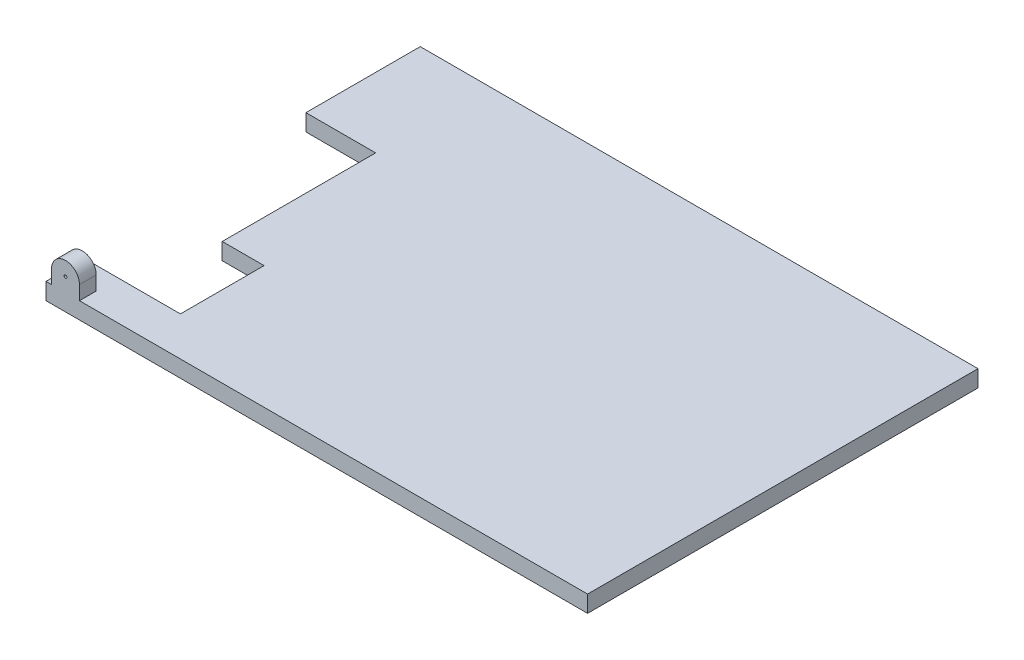
from build123d import *

# Parameters (mm, degrees)
BOSS_EXTRUDE1_DEPTH = 6
SKETCH2_R           = 0.5
BOSS_EXTRUDE2_DEPTH = 6


with BuildPart() as part:
    # Sketch1 → Boss-Extrude1 (new body)
    with BuildSketch(Plane(origin=(0, 0, 0), x_dir=(1, 0, 0), z_dir=(0, 1, 0))):
        Polygon((5.804365786, 4.796692747), (5.804365786, 10.796692747), (5.804365786, 18.796692747), (18.804365786, 18.796692747), (25, 18.796692747), (40, 18.796692747), (40, 48.796692747), (25, 48.796692747), (25, 103.796692747), (0, 103.796692747), (0, 144.796692747), (200, 144.796692747), (200, 4.796692747), align=None)
    extrude(amount=BOSS_EXTRUDE1_DEPTH)

    # Sketch2 → Boss-Extrude2 (add)
    with BuildSketch(Plane.XY.offset(-4.796692747)):
        with BuildLine():
            Line((7.804365786, 6), (17.804365786, 6))
            Line((17.804365786, 6), (17.804365786, 11))
            ThreePointArc((17.804365786, 11), (12.804365786, 16), (7.804365786, 11))
            Line((7.804365786, 11), (7.804365786, 6))
        make_face()
        with Locations((12.804365786, 11)):
            Circle(SKETCH2_R, mode=Mode.SUBTRACT)
    extrude(amount=-BOSS_EXTRUDE2_DEPTH)


solid = part.part
